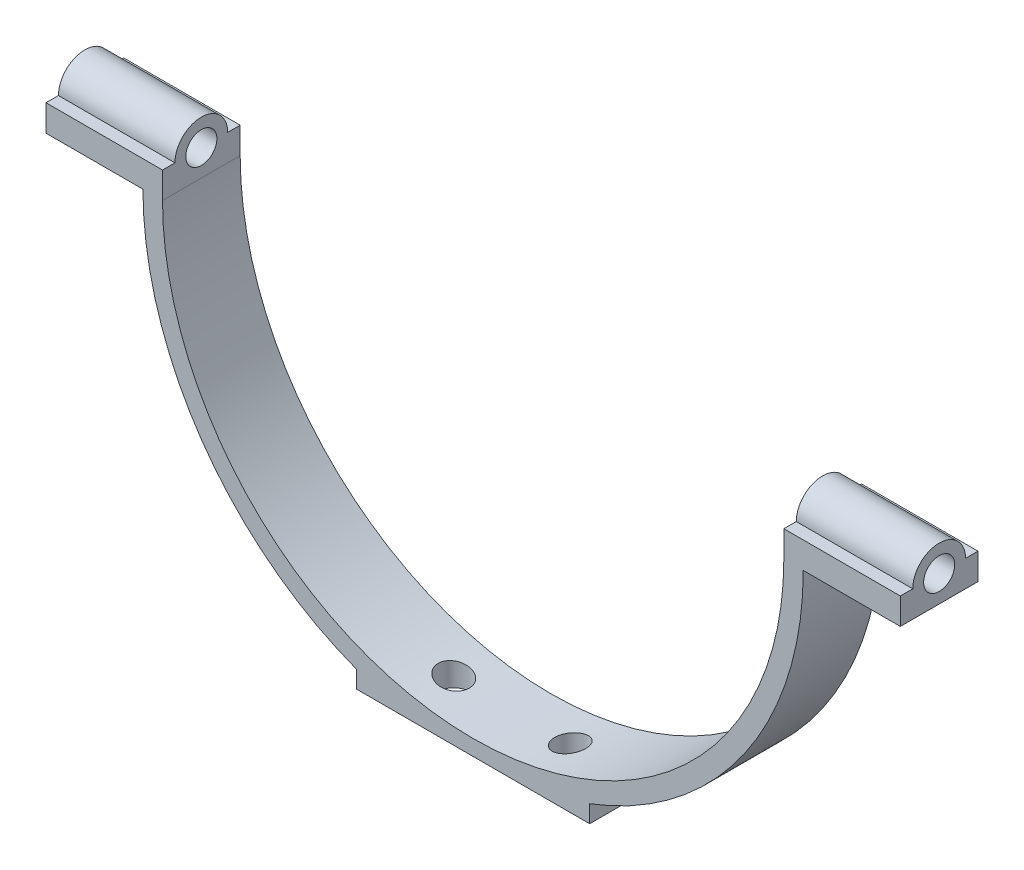
from build123d import *

# Parameters (mm, degrees)
BOSS_EXTRUDE1_DEPTH = 6.35
SKETCH2_R           = 2.54
BOSS_EXTRUDE2_DEPTH = 19.05
SKETCH3_R           = 2.54
CUT_EXTRUDE1_DEPTH  = 19.05


with BuildPart() as part:
    # Sketch1 → Boss-Extrude1 (new, symmetric)
    with BuildSketch(Plane.XY):
        with BuildLine():
            Line((0, -53.34), (19.05, -53.34))
            Line((19.05, -53.34), (19.05, -50.501466563))
            ThreePointArc((19.05, -50.501466563), (44.393267367, -30.700788874), (53.975, 0))
            Line((53.975, 0), (50.8, 0))
            ThreePointArc((50.8, 0), (0, -50.8), (-50.8, 0))
            Line((-50.8, 0), (-54.0004, 0))
            ThreePointArc((-54.0004, 0), (-44.411433326, -30.71917626), (-19.05, -50.528612688))
            Line((-19.05, -50.528612688), (-19.05, -53.34))
            Line((-19.05, -53.34), (0, -53.34))
        make_face()
    extrude(amount=BOSS_EXTRUDE1_DEPTH, both=True)

    # Sketch2 → Boss-Extrude2 (add)
    with BuildSketch(Plane(origin=(50.8, 0, 0), x_dir=(0, 0, -1), z_dir=(1, 0, 0))):
        with BuildLine():
            Line((-6.35, 0), (6.35, 0))
            Line((6.35, 0), (6.35, 4.318))
            Line((6.35, 4.318), (4.318, 4.318))
            ThreePointArc((4.318, 4.318), (0, 8.636), (-4.318, 4.318))
            Line((-4.318, 4.318), (-6.35, 4.318))
            Line((-6.35, 4.318), (-6.35, 0))
        make_face()
        with Locations(Location((0, 4.318, 0), (0, 0, 180))):
            Circle(SKETCH2_R, mode=Mode.SUBTRACT)
    boss_extrude2 = extrude(amount=BOSS_EXTRUDE2_DEPTH)

    # Mirror1: Boss-Extrude2 across plane
    add(boss_extrude2.mirror(Plane(origin=(0, 0, 0), x_dir=(0, 0, 1), z_dir=(1, 0, 0))))

    # Sketch3 → Cut-Extrude1 (cut)
    with BuildSketch(Plane.XZ.offset(53.34)):
        with Locations(Location((-9.525, 0, 0), (0, 0, 270))):
            Circle(SKETCH3_R)
        with Locations(Location((9.525, 0, 0), (0, 0, 270))):
            Circle(SKETCH3_R)
    extrude(amount=-CUT_EXTRUDE1_DEPTH, mode=Mode.SUBTRACT)


solid = part.part
